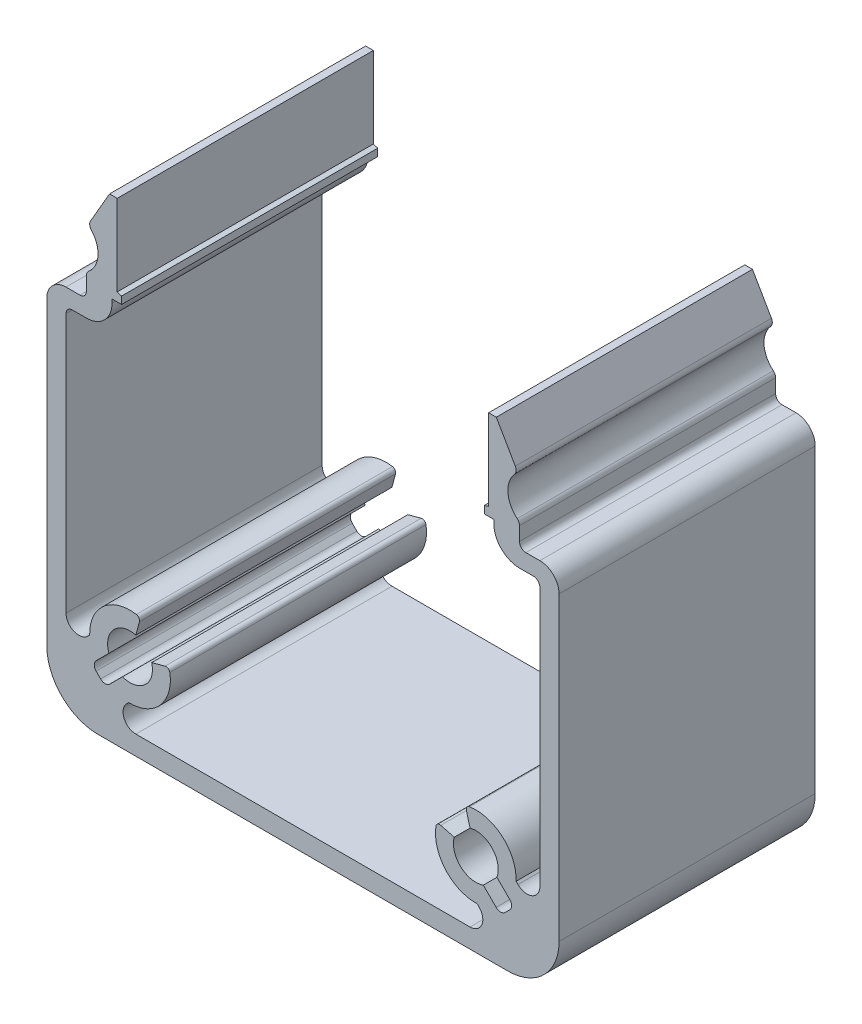
from build123d import *

# Parameters (mm, degrees)
BOSS_EXTRUDE1_DEPTH = 20


with BuildPart() as part:
    # Sketch1 → Boss-Extrude1 (new body)
    with BuildSketch(Plane.XY.offset(20)):
        with BuildLine():
            Line((4, 0), (36, 0))
            ThreePointArc((36, 0), (38.828427125, 1.171572875), (40, 4))
            Line((40, 4), (40, 27.499999994))
            ThreePointArc((40, 27.499999994), (39.56066017, 28.56066017), (38.499999994, 29))
            Line((38.499999994, 29), (37.408493132, 29))
            ThreePointArc((37.408493132, 29), (37.05493974, 29.14644661), (36.90849313, 29.500000002))
            Line((36.90849313, 29.500000002), (36.90849313, 30.572020267))
            ThreePointArc((36.90849313, 30.572020267), (36.86079319, 30.785150869), (36.726794508, 30.957616203))
            ThreePointArc((36.726794508, 30.957616203), (36.005111578, 32.357100716), (36.519951827, 33.845160752))
            ThreePointArc((36.519951827, 33.845160752), (36.647077826, 34.128030253), (36.582952488, 34.431450944))
            Line((36.582952488, 34.431450944), (35.099999998, 37.000000001))
            Line((35.099999998, 37.000000001), (34.500000002, 37.000000001))
            Line((34.500000002, 37.000000001), (34.500000002, 30.672689193))
            Line((34.500000002, 30.672689193), (34.158493132, 30.561067543))
            Line((34.158493132, 30.561067543), (34.158493132, 29.989862813))
            Line((34.158493132, 29.989862813), (34.908493132, 29.989862813))
            Line((34.908493132, 29.989862813), (34.908493132, 29.700000011))
            ThreePointArc((34.908493132, 29.700000011), (35.494279572, 28.285786443), (36.908493141, 27.700000003))
            Line((36.908493141, 27.700000003), (38.000000017, 27.700000003))
            ThreePointArc((38.000000017, 27.700000003), (38.353553409, 27.553553393), (38.500000019, 27.200000001))
            Line((38.500000019, 27.200000001), (38.500000019, 6.9547727))
            ThreePointArc((38.500000019, 6.9547727), (37.882683451, 6.030893167), (36.792893237, 6.247665919))
            Line((36.792893237, 6.247665919), (36.648161659, 6.392397496))
            ThreePointArc((36.648161659, 6.392397496), (35.587251229, 8.859212237), (33.009530056, 9.611581471))
            ThreePointArc((33.009530056, 9.611581471), (32.804700675, 9.478725012), (32.766463725, 9.237594653))
            Line((32.766463725, 9.237594653), (33.047066675, 8.190370192))
            ThreePointArc((33.047066675, 8.190370192), (34.786339421, 7.686520507), (35.148364083, 5.912296075))
            Line((35.148364083, 5.912296075), (36.146446608, 4.91421355))
            ThreePointArc((36.146446608, 4.91421355), (36.292893217, 4.560660161), (36.146446608, 4.207106773))
            Line((36.146446608, 4.207106773), (35.792893214, 3.853553379))
            ThreePointArc((35.792893214, 3.853553379), (35.439339826, 3.70710677), (35.085786437, 3.853553379))
            Line((35.085786437, 3.853553379), (34.087703906, 4.85163591))
            ThreePointArc((34.087703906, 4.85163591), (32.313479487, 5.213660585), (31.809629807, 6.952933321))
            Line((31.809629807, 6.952933321), (30.762405333, 7.233536272))
            ThreePointArc((30.762405333, 7.233536272), (30.521274984, 7.195299323), (30.38841853, 6.990469949))
            ThreePointArc((30.38841853, 6.990469949), (31.140787752, 4.412748784), (33.607602477, 3.351838341))
            Line((33.607602477, 3.351838341), (33.752334032, 3.207106785))
            ThreePointArc((33.752334032, 3.207106785), (33.969106782, 2.117316579), (33.045227255, 1.500000015))
            Line((33.045227255, 1.500000015), (6.954772716, 1.500000015))
            ThreePointArc((6.954772716, 1.500000015), (6.030893183, 2.117316583), (6.247665934, 3.207106797))
            Line((6.247665934, 3.207106797), (6.392397512, 3.351838375))
            ThreePointArc((6.392397512, 3.351838375), (8.859212224, 4.412748803), (9.611581449, 6.990469949))
            ThreePointArc((9.611581449, 6.990469949), (9.478724996, 7.195299323), (9.237594646, 7.233536272))
            Line((9.237594646, 7.233536272), (8.190370187, 6.952933328))
            ThreePointArc((8.190370187, 6.952933328), (7.686520502, 5.213660596), (5.912296085, 4.851635932))
            Line((5.912296085, 4.851635932), (4.914213553, 3.8535534))
            ThreePointArc((4.914213553, 3.8535534), (4.560660164, 3.707106791), (4.207106776, 3.8535534))
            Line((4.207106776, 3.8535534), (3.853553388, 4.207106787))
            ThreePointArc((3.853553388, 4.207106787), (3.70710678, 4.560660175), (3.853553388, 4.914213564))
            Line((3.853553388, 4.914213564), (4.85163592, 5.912296095))
            ThreePointArc((4.85163592, 5.912296095), (5.213660585, 7.686520517), (6.952933322, 8.190370198))
            Line((6.952933322, 8.190370198), (7.233536268, 9.237594644))
            ThreePointArc((7.233536268, 9.237594644), (7.195299318, 9.478725003), (6.990469936, 9.611581462))
            ThreePointArc((6.990469936, 9.611581462), (4.412748785, 8.859212233), (3.351838362, 6.392397513))
            Line((3.351838362, 6.392397513), (3.207106785, 6.247665935))
            ThreePointArc((3.207106785, 6.247665935), (2.11731657, 6.030893183), (1.500000002, 6.954772717))
            Line((1.500000002, 6.954772717), (1.500000002, 27.200000001))
            ThreePointArc((1.500000002, 27.200000001), (1.646446612, 27.553553393), (2.000000004, 27.700000003))
            Line((2.000000004, 27.700000003), (3.091506864, 27.700000003))
            ThreePointArc((3.091506864, 27.700000003), (4.505720432, 28.285786443), (5.091506872, 29.700000011))
            Line((5.091506872, 29.700000011), (5.091506872, 29.989862813))
            Line((5.091506872, 29.989862813), (5.841506868, 29.989862813))
            Line((5.841506868, 29.989862813), (5.841506868, 30.561067541))
            Line((5.841506868, 30.561067541), (5.499999998, 30.672689191))
            Line((5.499999998, 30.672689191), (5.499999998, 37.000000001))
            Line((5.499999998, 37.000000001), (4.899999998, 37.000000001))
            Line((4.899999998, 37.000000001), (3.417047508, 34.431450944))
            ThreePointArc((3.417047508, 34.431450944), (3.35292217, 34.128030253), (3.480048169, 33.845160751))
            ThreePointArc((3.480048169, 33.845160751), (3.99488842, 32.357100716), (3.273205491, 30.957616203))
            ThreePointArc((3.273205491, 30.957616203), (3.13920681, 30.785150869), (3.09150687, 30.572020267))
            Line((3.09150687, 30.572020267), (3.09150687, 29.500000002))
            ThreePointArc((3.09150687, 29.500000002), (2.94506026, 29.14644661), (2.591506868, 29))
            Line((2.591506868, 29), (1.500000006, 29))
            ThreePointArc((1.500000006, 29), (0.43933983, 28.56066017), (0, 27.499999994))
            Line((0, 27.499999994), (0, 4))
            ThreePointArc((0, 4), (1.171572875, 1.171572875), (4, 0))
        make_face()
    extrude(amount=-BOSS_EXTRUDE1_DEPTH)


solid = part.part
